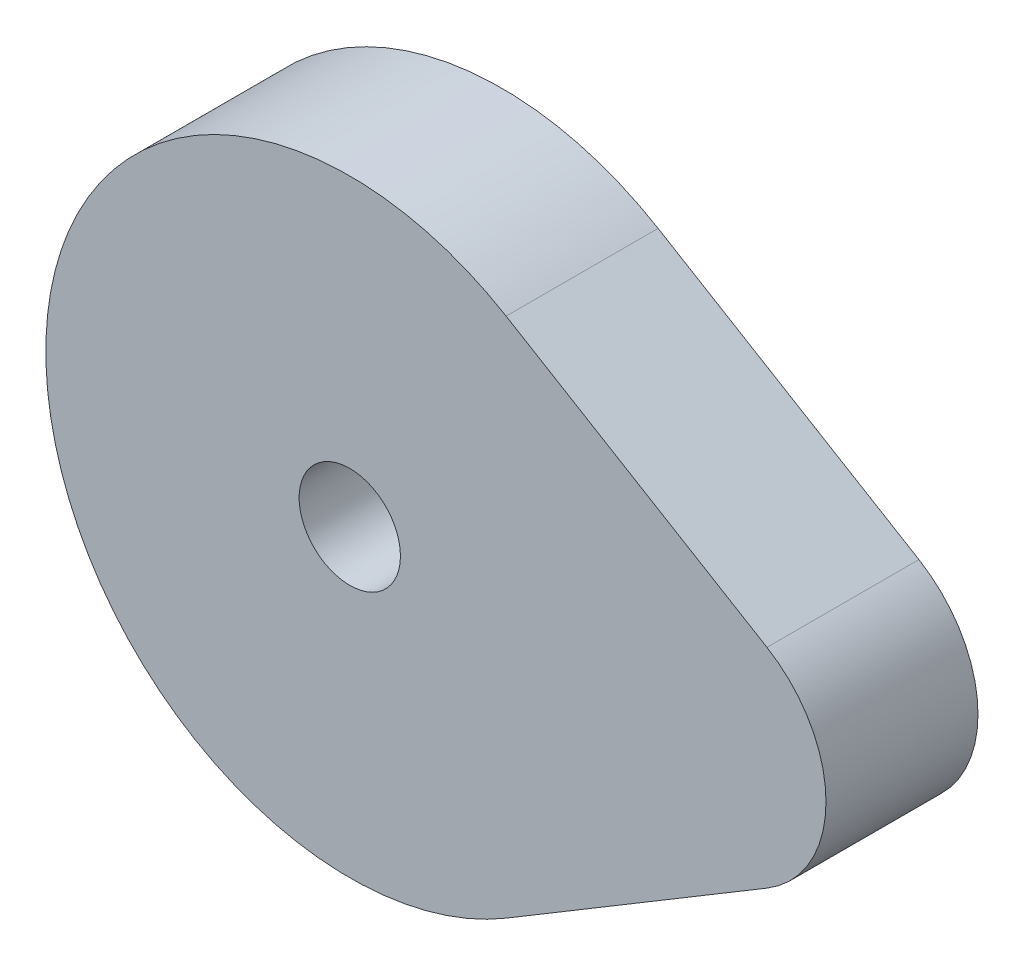
from build123d import *

# Parameters (mm, degrees)
CROQUIS1_R              = 5
SALIENTE_EXTRUIR1_DEPTH = 15


with BuildPart() as part:
    # Croquis1 → Saliente-Extruir1 (new body)
    with BuildSketch(Plane.XY):
        with BuildLine():
            Line((41.171428571, -10.291426985), (15.428571429, -25.728567463))
            ThreePointArc((15.428571429, -25.728567463), (-30, 0), (15.428571429, 25.728567463))
            Line((15.428571429, 25.728567463), (41.171428571, 10.291426985))
            ThreePointArc((41.171428571, 10.291426985), (47, 0), (41.171428571, -10.291426985))
        make_face()
        Circle(CROQUIS1_R, mode=Mode.SUBTRACT)
    extrude(amount=SALIENTE_EXTRUIR1_DEPTH)


solid = part.part
